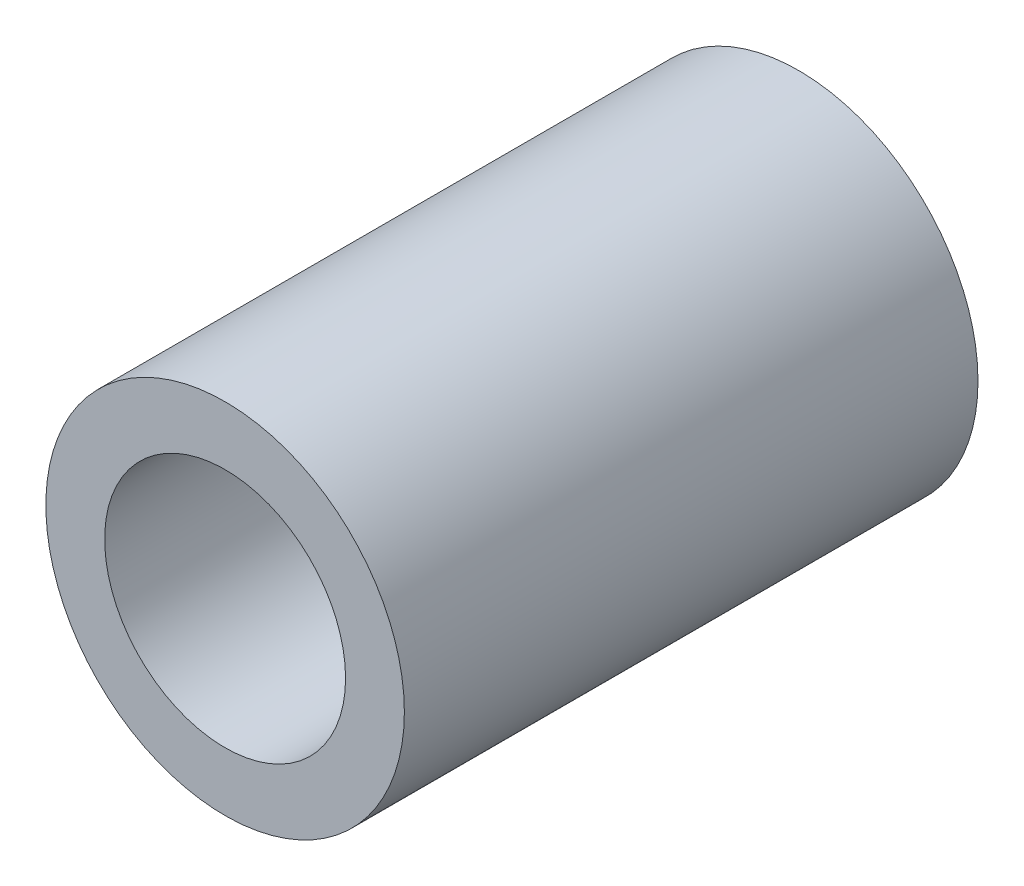
from build123d import *

# Parameters (mm, degrees)
SKETCH1_W = 50.8
SKETCH1_H = 5.207


with BuildPart() as part:
    # Sketch1 → Revolve1 (revolve)
    with BuildSketch(Plane(origin=(0, 0, 0), x_dir=(0, 0, -1), z_dir=(1, 0, 0)), mode=Mode.PRIVATE) as revolve1_sk:
        with Locations((160.02, 1019.7465)):
            Rectangle(SKETCH1_W, SKETCH1_H)
    revolve(revolve1_sk.sketch.rotate(Axis((0, 1006.475, 0), (0, 0, -1)), 90), axis=Axis((0, 1006.475, 0), (0, 0, -1)))


solid = part.part
